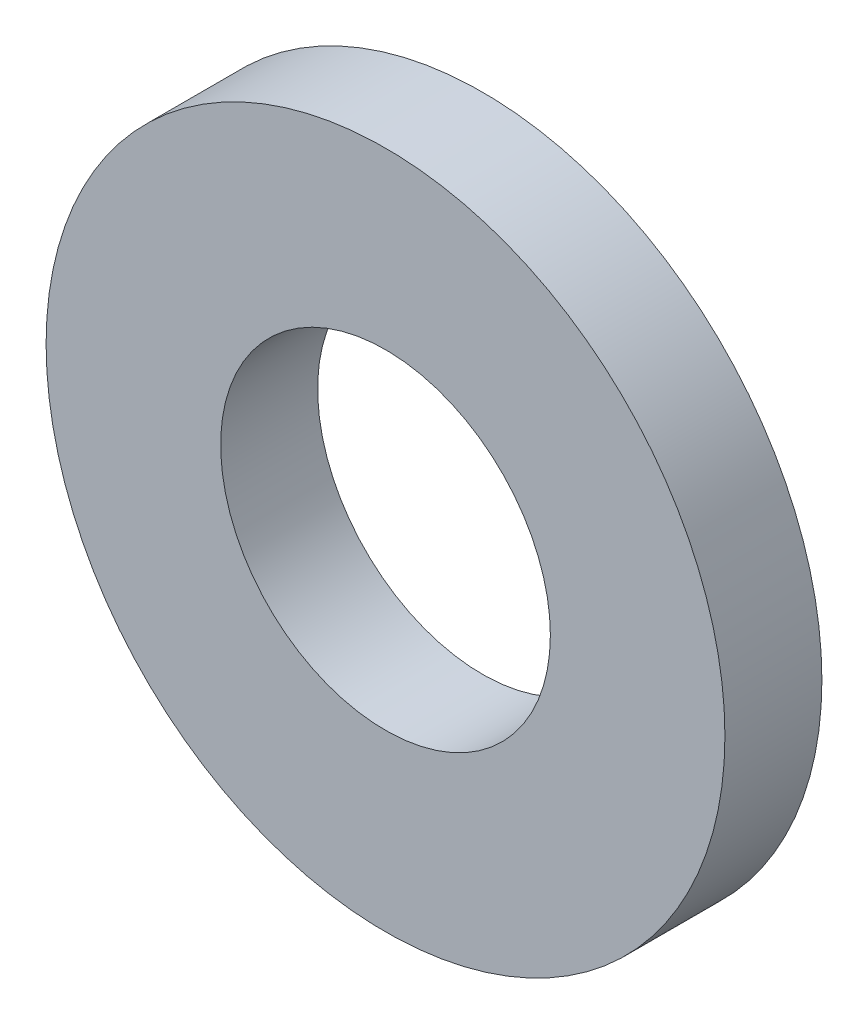
from build123d import *

# Parameters (mm, degrees)
SKETCH_1_R            = 3.5
EXTRUDE_246_DEPTH     = 1
SKETCH_2_R            = 1.7
CUT_EXTRUDE_315_DEPTH = 1


with BuildPart() as part:
    # 草图1 → Extrude 246 (new body)
    with BuildSketch(Plane.XY):
        Circle(SKETCH_1_R)
    extrude(amount=EXTRUDE_246_DEPTH)

    # 草图2 → Cut-Extrude 315 (cut)
    with BuildSketch(Plane.XY):
        Circle(SKETCH_2_R)
    extrude(amount=CUT_EXTRUDE_315_DEPTH, mode=Mode.SUBTRACT)


solid = part.part
